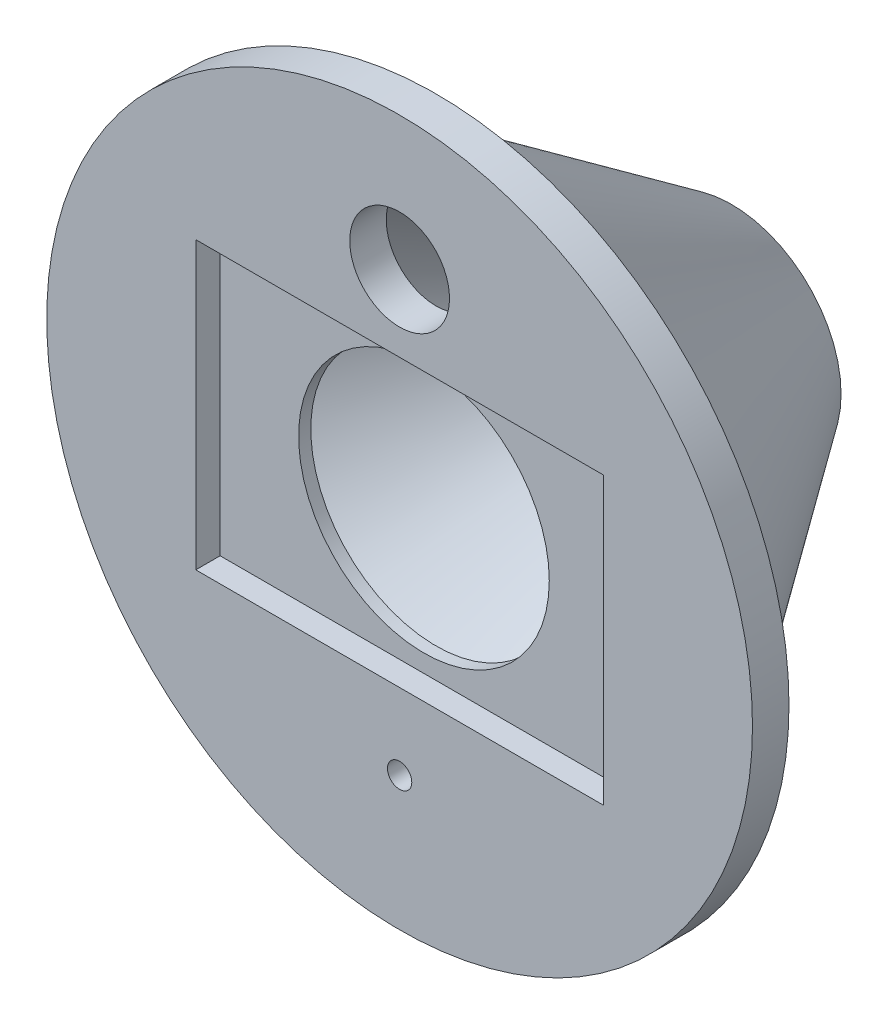
from build123d import *

# Parameters (mm, degrees)
SKETCH1_R                 = 9
SEAL_CONE_DEPTH           = 24.278516115
SEAL_CONE_DRAFT           = -35
SKETCH2_R                 = 7
CONE_HOLLOW_DEPTH         = 24.278516115
CONE_HOLLOW_DRAFT         = -35
SKETCH3_R                 = 29
TOP_PLATE_DEPTH           = 3
SKETCH4_W                 = 33.5
SKETCH4_H                 = 23.5
MQ3_PCB_POCKET_DEPTH      = 1.25
SKETCH5_R                 = 10.3
SKETCH5_R_2               = 4.1
SKETCH5_R_3               = 1
CAN_HOSE_VENT_HOLES_DEPTH = 1.9


with BuildPart() as part:
    # Sketch1 → Seal_cone (with draft: the straight prism first)
    with BuildSketch(Plane.XY):
        Circle(SKETCH1_R)
    extrude(amount=SEAL_CONE_DEPTH)
    # Seal_cone: the draft: its side faces are tilted about the plane it starts from
    seal_cone_sides = [part.faces().sort_by_distance(p)[0] for p in [
        (-9, 0, 12.139258057),
    ]]
    draft(seal_cone_sides, Plane.XY, SEAL_CONE_DRAFT)


with BuildPart() as cone_hollow_tool:
    # Sketch2 → Cone_hollow (with draft: the straight prism first)
    with BuildSketch(Plane.XY):
        Circle(SKETCH2_R)
    extrude(amount=CONE_HOLLOW_DEPTH)
    # Cone_hollow: the draft: its side faces are tilted about the plane it starts from
    cone_hollow_sides = [cone_hollow_tool.faces().sort_by_distance(p)[0] for p in [
        (-7, 0, 12.139258057),
    ]]
    draft(cone_hollow_sides, Plane.XY, CONE_HOLLOW_DRAFT)


with BuildPart() as part_1:
    add(part.part)

    # Cone_hollow: cut by cone_hollow_tool
    add(cone_hollow_tool.part, mode=Mode.SUBTRACT)

    # Sketch3 → Top_plate (add)
    with BuildSketch(Plane.XY.offset(24.278516115)):
        Circle(SKETCH3_R)
    extrude(amount=TOP_PLATE_DEPTH)

    # Sketch4 → MQ3_pcb_pocket (cut, symmetric)
    with BuildSketch(Plane.XY.offset(26.528516115)):
        Rectangle(SKETCH4_W, SKETCH4_H)
    extrude(amount=MQ3_PCB_POCKET_DEPTH, both=True, mode=Mode.SUBTRACT)

    # Sketch5 → Can_hose_vent_holes (cut, symmetric)
    with BuildSketch(Plane.XY.offset(25.878516115)):
        Circle(SKETCH5_R)
        with Locations((0, 18)):
            Circle(SKETCH5_R_2)
        with Locations((0, -18)):
            Circle(SKETCH5_R_3)
    extrude(amount=CAN_HOSE_VENT_HOLES_DEPTH, both=True, mode=Mode.SUBTRACT)


solid = part_1.part
